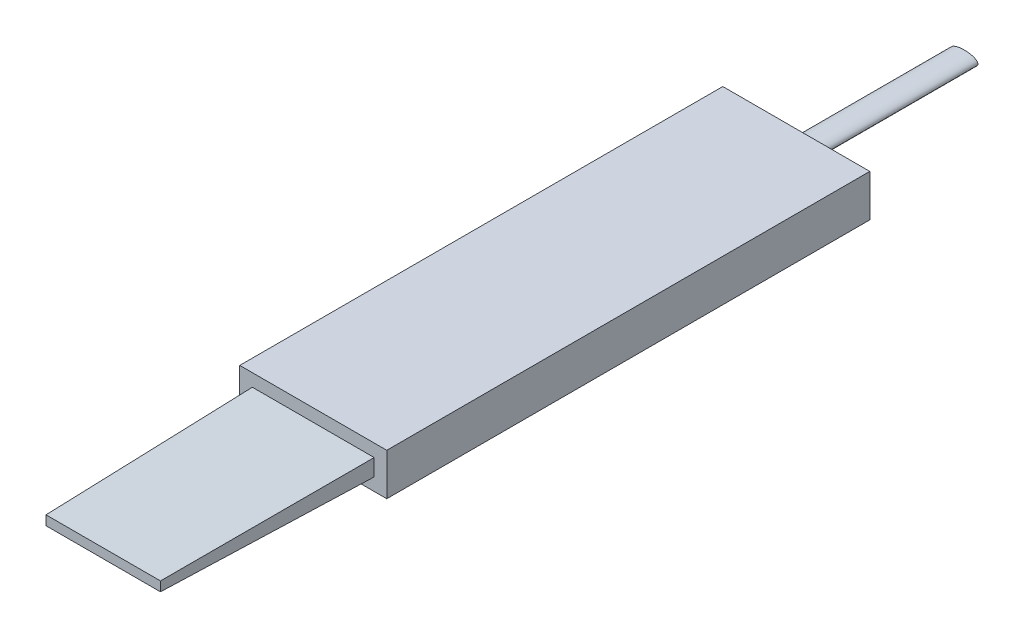
from build123d import *

# Parameters (mm, degrees)
SKETCH1_W           = 35
SKETCH1_H           = 115
BOSS_EXTRUDE1_DEPTH = 10
SKETCH2_W           = 29
SKETCH2_H           = 4
BOSS_EXTRUDE2_DEPTH = 50
BOSS_EXTRUDE2_TAPER = 1
SKETCH3_RX          = 3.259941838
SKETCH3_RY          = 1.279729234
BOSS_EXTRUDE3_DEPTH = 40


with BuildPart() as part:
    # Sketch1 → Boss-Extrude1 (new body)
    with BuildSketch(Plane(origin=(0, 0, 0), x_dir=(1, 0, 0), z_dir=(0, 1, 0))):
        with Locations((-24.573170732, -22.073170732)):
            Rectangle(SKETCH1_W, SKETCH1_H)
    extrude(amount=BOSS_EXTRUDE1_DEPTH)

    # Sketch2 → Boss-Extrude2 (add)
    with BuildSketch(Plane.XY.offset(79.573170732)):
        with Locations((-24.573170732, 5)):
            Rectangle(SKETCH2_W, SKETCH2_H)
    extrude(amount=BOSS_EXTRUDE2_DEPTH, taper=BOSS_EXTRUDE2_TAPER)

    # Sketch3 → Boss-Extrude3 (add)
    with BuildSketch(Plane(origin=(0, 0, -35.426829268), x_dir=(-1, 0, 0), z_dir=(0, 0, -1))):
        with Locations((24.573170732, 5)):
            Ellipse(SKETCH3_RX, SKETCH3_RY)
    extrude(amount=BOSS_EXTRUDE3_DEPTH)


solid = part.part
